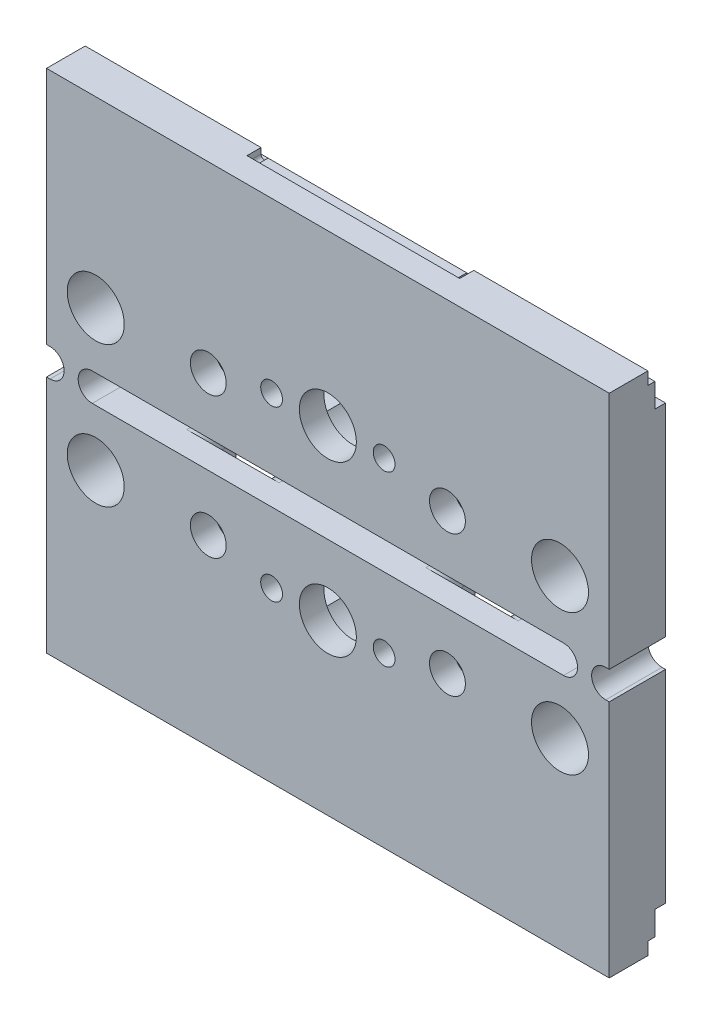
from build123d import *

# Parameters (mm, degrees)
SKETCH_2_W           = 80
SKETCH_2_H           = 34
SKETCH_2_R           = 4.05
EXTRUDE_1_DEPTH      = 8
SKETCH_3_R           = 2.55
CUT_EXTRUDE_1_DEPTH  = 88.292611371
CUT_EXTRUDE_2_DEPTH  = 88.292611371
SKETCH_5_R           = 1.55
CUT_EXTRUDE_3_DEPTH  = 88.292611371
CUT_EXTRUDE_4_DEPTH  = 4.5
CUT_EXTRUDE_5_DEPTH  = 4.5
SKETCH_20_R          = 5.5
CUT_EXTRUDE_12_DEPTH = 4.5
CUT_EXTRUDE_11_DEPTH = 2
EXTRUDE_2_DEPTH      = 8


with BuildPart() as part:
    # 草图2 → 凸台-拉伸1 (new body)
    with BuildSketch(Plane.XY):
        with Locations((40, 17)):
            Rectangle(SKETCH_2_W, SKETCH_2_H)
        with Locations((7, 8)):
            Circle(SKETCH_2_R, mode=Mode.SUBTRACT)
        with Locations((40, 10)):
            Circle(SKETCH_2_R, mode=Mode.SUBTRACT)
        with Locations((73, 8)):
            Circle(SKETCH_2_R, mode=Mode.SUBTRACT)
    extrude_1 = extrude(amount=EXTRUDE_1_DEPTH)

    # 草图3 → 切除-拉伸1 (cut, through all)
    with BuildSketch(Plane.XY.offset(8)):
        with Locations((23, 8)):
            Circle(SKETCH_3_R)
        with Locations((57, 8)):
            Circle(SKETCH_3_R)
    cut_extrude_1 = extrude(amount=-CUT_EXTRUDE_1_DEPTH, mode=Mode.SUBTRACT)

    # 草图4 → 切除-拉伸2 (cut, through all)
    with BuildSketch(Plane(origin=(80, 0, 0), x_dir=(0, 0, -1), z_dir=(1, 0, 0))):
        Polygon((-1.5, 32.2), (-2.5, 32.2), (-2.5, 34), (0, 34), (0, 28.8), (-1.5, 28.8), align=None)
    cut_extrude_2 = extrude(amount=-CUT_EXTRUDE_2_DEPTH, mode=Mode.SUBTRACT)

    # 草图5 → 切除-拉伸3 (cut, through all)
    with BuildSketch(Plane.XY.offset(8)):
        with Locations((48, 10)):
            Circle(SKETCH_5_R)
        with Locations((32, 10)):
            Circle(SKETCH_5_R)
    cut_extrude_3 = extrude(amount=-CUT_EXTRUDE_3_DEPTH, mode=Mode.SUBTRACT)

    # 草图7 → 切除-拉伸4 (cut)
    with BuildSketch(Plane(origin=(0, 0, 0), x_dir=(-1, 0, 0), z_dir=(0, 0, -1))):
        with BuildLine():
            Line((-27.05, 10), (-27.05, 2.5))
            ThreePointArc((-27.05, 2.5), (-27.782233047, 0.732233047), (-29.55, 0))
            Line((-29.55, 0), (-16.45, 0))
            ThreePointArc((-16.45, 0), (-18.217766953, 0.732233047), (-18.95, 2.5))
            Line((-18.95, 2.5), (-18.95, 10))
            ThreePointArc((-18.95, 10), (-23, 14.05), (-27.05, 10))
        make_face()
        with BuildLine():
            Line((-61.05, 2.5), (-61.05, 10))
            ThreePointArc((-61.05, 10), (-57, 14.05), (-52.95, 10))
            Line((-52.95, 10), (-52.95, 2.5))
            ThreePointArc((-52.95, 2.5), (-52.217766953, 0.732233047), (-50.45, 0))
            Line((-50.45, 0), (-63.55, 0))
            ThreePointArc((-63.55, 0), (-61.782233047, 0.732233047), (-61.05, 2.5))
        make_face()
    cut_extrude_4 = extrude(amount=-CUT_EXTRUDE_4_DEPTH, mode=Mode.SUBTRACT)

    # 草图8 → 切除-拉伸5 (cut)
    with BuildSketch(Plane(origin=(0, 0, 0), x_dir=(-1, 0, 0), z_dir=(0, 0, -1))):
        with BuildLine():
            Line((-30.5, 12.85), (-49.5, 12.85))
            ThreePointArc((-49.5, 12.85), (-52.35, 10), (-49.5, 7.15))
            Line((-49.5, 7.15), (-30.5, 7.15))
            ThreePointArc((-30.5, 7.15), (-27.65, 10), (-30.5, 12.85))
        make_face()
    cut_extrude_5 = extrude(amount=-CUT_EXTRUDE_5_DEPTH, mode=Mode.SUBTRACT)

    # 草图20 → 切除-拉伸12 (cut)
    with BuildSketch(Plane(origin=(0, 0, 0), x_dir=(-1, 0, 0), z_dir=(0, 0, -1))):
        with Locations((-40, 10)):
            Circle(SKETCH_20_R)
    cut_extrude_12 = extrude(amount=-CUT_EXTRUDE_12_DEPTH, mode=Mode.SUBTRACT)

    # 草图19 → 切除-拉伸11 (cut)
    with BuildSketch(Plane(origin=(0, 0, 2.5), x_dir=(-1, 0, 0), z_dir=(0, 0, -1))):
        with BuildLine():
            Line((-25, 34), (-55.247938178, 34))
            Line((-55.247938178, 34), (-55.247938178, 33.2))
            ThreePointArc((-55.247938178, 33.2), (-54.747938178, 32.7), (-54.247938178, 33.2))
            Line((-54.247938178, 33.2), (-26, 33.2))
            ThreePointArc((-26, 33.2), (-25.5, 32.7), (-25, 33.2))
            Line((-25, 33.2), (-25, 34))
        make_face()
    cut_extrude_11 = extrude(amount=-CUT_EXTRUDE_11_DEPTH, mode=Mode.SUBTRACT)

    # 草图22 → 凸台-拉伸2 (add)
    with BuildSketch(Plane.XY.offset(8)):
        with BuildLine():
            Line((0.5, -4), (6.5, -4))
            ThreePointArc((6.5, -4), (4.5, -2), (6.5, 0))
            Line((6.5, 0), (0.5, 0))
            ThreePointArc((0.5, 0), (2.5, -2), (0.5, -4))
        make_face()
        with BuildLine():
            Line((79.5, 0), (73.5, 0))
            ThreePointArc((73.5, 0), (75.5, -2), (73.5, -4))
            Line((73.5, -4), (79.5, -4))
            ThreePointArc((79.5, -4), (77.5, -2), (79.5, 0))
        make_face()
    extrude(amount=-EXTRUDE_2_DEPTH)

    # 镜向2: 凸台-拉伸1, 切除-拉伸1, 切除-拉伸2, 切除-拉伸3, 切除-拉伸4, 切除-拉伸5, 切除-拉伸12, 切除-拉伸11 across plane
    add(extrude_1.mirror(Plane(origin=(0, -2, 0), x_dir=(0, 0, 1), z_dir=(0, -1, 0))))
    add(cut_extrude_1.mirror(Plane(origin=(0, -2, 0), x_dir=(0, 0, 1), z_dir=(0, -1, 0))), mode=Mode.SUBTRACT)
    add(cut_extrude_2.mirror(Plane(origin=(0, -2, 0), x_dir=(0, 0, 1), z_dir=(0, -1, 0))), mode=Mode.SUBTRACT)
    add(cut_extrude_3.mirror(Plane(origin=(0, -2, 0), x_dir=(0, 0, 1), z_dir=(0, -1, 0))), mode=Mode.SUBTRACT)
    add(cut_extrude_4.mirror(Plane(origin=(0, -2, 0), x_dir=(0, 0, 1), z_dir=(0, -1, 0))), mode=Mode.SUBTRACT)
    add(cut_extrude_5.mirror(Plane(origin=(0, -2, 0), x_dir=(0, 0, 1), z_dir=(0, -1, 0))), mode=Mode.SUBTRACT)
    add(cut_extrude_12.mirror(Plane(origin=(0, -2, 0), x_dir=(0, 0, 1), z_dir=(0, -1, 0))), mode=Mode.SUBTRACT)
    add(cut_extrude_11.mirror(Plane(origin=(0, -2, 0), x_dir=(0, 0, 1), z_dir=(0, -1, 0))), mode=Mode.SUBTRACT)


solid = part.part
